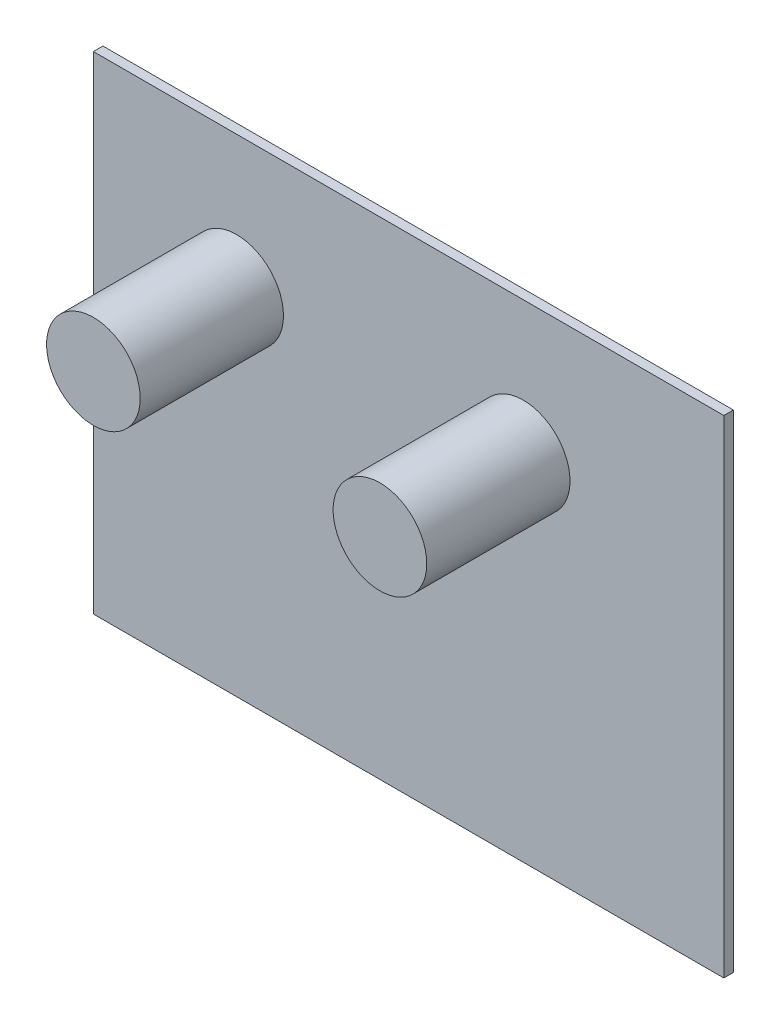
from build123d import *

# Parameters (mm, degrees)
ESQUISSE2_W        = 66
ESQUISSE2_H        = 51
ESQUISSE2_R        = 6
ESQUISSE2_W_2      = 20
ESQUISSE2_H_2      = 41
ESQUISSE2_R_2      = 4.9
BOSS_EXTRU_1_DEPTH = 1
ESQUISSE4_R        = 4.9
BOSS_EXTRU_2_DEPTH = 15


with BuildPart() as part:
    # Esquisse2 → Boss.-Extru.1 (new body)
    # profile 1 of 5: a face of its own
    with BuildSketch(Plane.XY):
        with Locations((33, 25.5)):
            Rectangle(ESQUISSE2_W, ESQUISSE2_H)
        with Locations((55, 37)):
            Circle(ESQUISSE2_R, mode=Mode.SUBTRACT)
        with Locations((15, 25.5)):
            Rectangle(ESQUISSE2_W_2, ESQUISSE2_H_2, mode=Mode.SUBTRACT)
    # profile 2 of 5: a face of its own
    with BuildSketch(Plane.XY):
        with Locations((15, 25.5)):
            Rectangle(ESQUISSE2_W_2, ESQUISSE2_H_2)
        with Locations((15, 37)):
            Circle(ESQUISSE2_R_2, mode=Mode.SUBTRACT)
    # profile 3 of 5: a face of its own
    with BuildSketch(Plane.XY):
        with Locations((15, 37)):
            Circle(ESQUISSE2_R_2)
    # profile 4 of 5: a face of its own
    with BuildSketch(Plane.XY):
        with Locations((55, 37)):
            Circle(ESQUISSE2_R)
        with Locations((55, 37)):
            Circle(ESQUISSE2_R_2, mode=Mode.SUBTRACT)
    # profile 5 of 5: a face of its own
    with BuildSketch(Plane.XY):
        with Locations((55, 37)):
            Circle(ESQUISSE2_R_2)
    extrude(amount=BOSS_EXTRU_1_DEPTH)

    # Esquisse4 → Boss.-Extru.2 (add)
    with BuildSketch(Plane.XY.offset(1)):
        with Locations((15, 37)):
            Circle(ESQUISSE4_R)
        with Locations((45, 37)):
            Circle(ESQUISSE4_R)
    extrude(amount=BOSS_EXTRU_2_DEPTH)


solid = part.part
